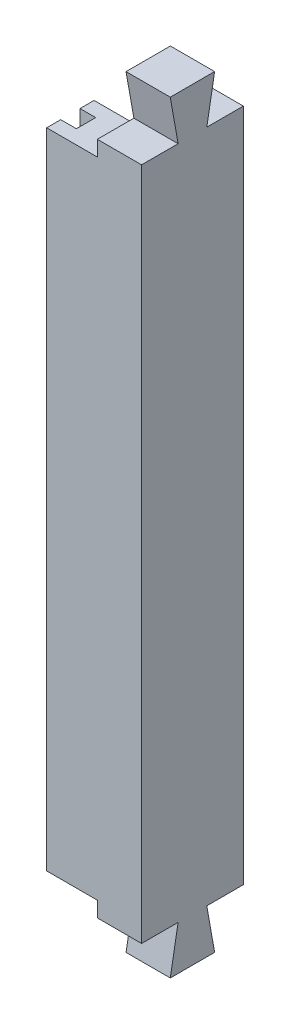
from build123d import *

# Parameters (mm, degrees)
SKETCH1_W           = 20
SKETCH1_H           = 344.8
BOSS_EXTRUDE1_DEPTH = 46
SKETCH2_W           = 6.35
SKETCH2_H           = 290.9
BOSS_EXTRUDE2_DEPTH = 22.9
CUT_EXTRUDE1_DEPTH  = 20
SKETCH2_3_W         = 8.73125
SKETCH2_3_H         = 290.9
BOSS_EXTRUDE3_DEPTH = 15.8


with BuildPart() as part:
    # Sketch1 → Boss-Extrude1 (new body)
    with BuildSketch(Plane.XY):
        Rectangle(SKETCH1_W, SKETCH1_H)
    extrude(amount=BOSS_EXTRUDE1_DEPTH)

    # Sketch2 → Boss-Extrude2 (add)
    with BuildSketch(Plane.ZY.offset(10)):
        with Locations((42.825, 0)):
            Rectangle(SKETCH2_W, SKETCH2_H)
        with Locations((27.74375, 0)):
            Rectangle(SKETCH2_W, SKETCH2_H)
    extrude(amount=BOSS_EXTRUDE2_DEPTH)

    # Sketch3 → Cut-Extrude1 (cut)
    with BuildSketch(Plane.ZY.offset(10)):
        Polygon((46, -172.4), (46, -152.4), (29.491, -152.4), (33.0175, -172.4), align=None)
        Polygon((0, 172.4), (0, 152.4), (16.509, 152.4), (12.9825, 172.4), align=None)
        Polygon((12.9825, -172.4), (16.509, -152.4), (0, -152.4), (0, -172.4), align=None)
        Polygon((33.0175, 172.4), (29.491, 152.4), (46, 152.4), (46, 172.4), align=None)
    extrude(amount=-CUT_EXTRUDE1_DEPTH, mode=Mode.SUBTRACT)

    # Sketch2<3> → Boss-Extrude3 (add)
    with BuildSketch(Plane.ZY.offset(10)):
        with Locations((35.284375, 0)):
            Rectangle(SKETCH2_3_W, SKETCH2_3_H)
    extrude(amount=BOSS_EXTRUDE3_DEPTH)


solid = part.part
